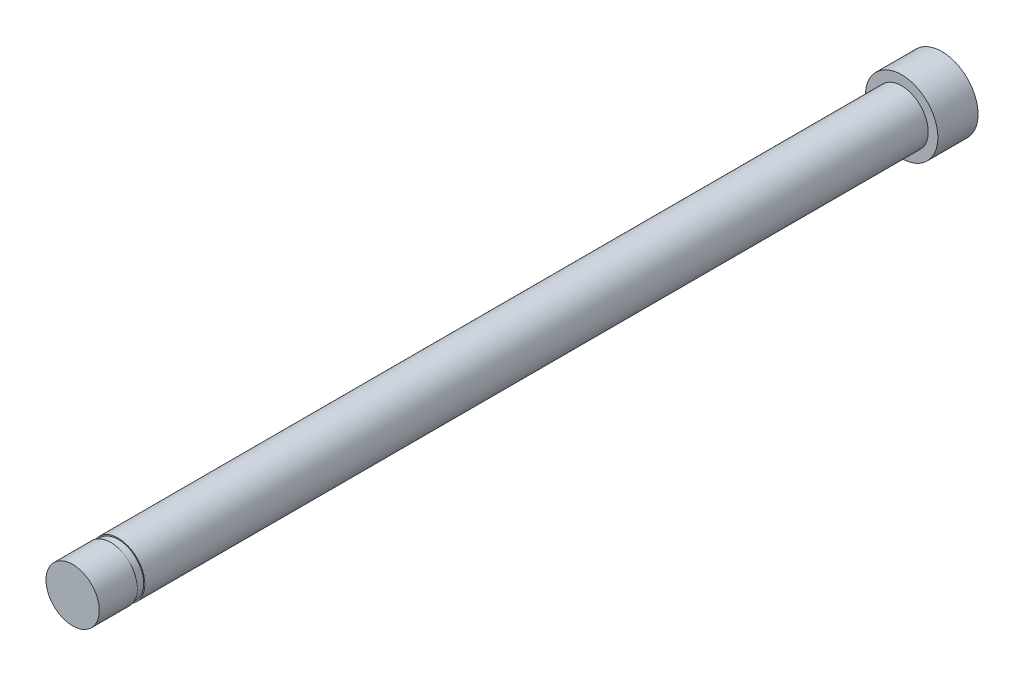
from build123d import *

# Parameters (mm, degrees)
SKETCH1_R           = 2.5
BOSS_EXTRUDE1_DEPTH = 40.767
SKETCH2_W           = 0.7
SKETCH2_H           = 0.1
SKETCH4_R           = 3.402225697
BOSS_EXTRUDE2_DEPTH = 3.772200388


with BuildPart() as part:
    # Sketch1 → Boss-Extrude1 (new, symmetric)
    with BuildSketch(Plane.XY):
        with Locations(Location((0, 0, 0), (0, 0, 180))):
            Circle(SKETCH1_R)
    extrude(amount=BOSS_EXTRUDE1_DEPTH, both=True)

    # Sketch2 → Cut-Revolve1 (revolve, cut)
    with BuildSketch(Plane(origin=(0, 0, 0), x_dir=(0, 0, -1), z_dir=(1, 0, 0)), mode=Mode.PRIVATE) as cut_revolve1_sk:
        with Locations((-36.848037041, 2.45)):
            Rectangle(SKETCH2_W, SKETCH2_H)
    revolve(cut_revolve1_sk.sketch.rotate(Axis((0, 0, 40.767), (0, 0, -1)), 270), axis=Axis((0, 0, 40.767), (0, 0, -1)), mode=Mode.SUBTRACT)

    # Sketch4 → Boss-Extrude2 (add)
    with BuildSketch(Plane(origin=(0, 0, -40.767), x_dir=(-1, 0, 0), z_dir=(0, 0, -1))):
        Circle(SKETCH4_R)
    extrude(amount=-BOSS_EXTRUDE2_DEPTH)


solid = part.part
